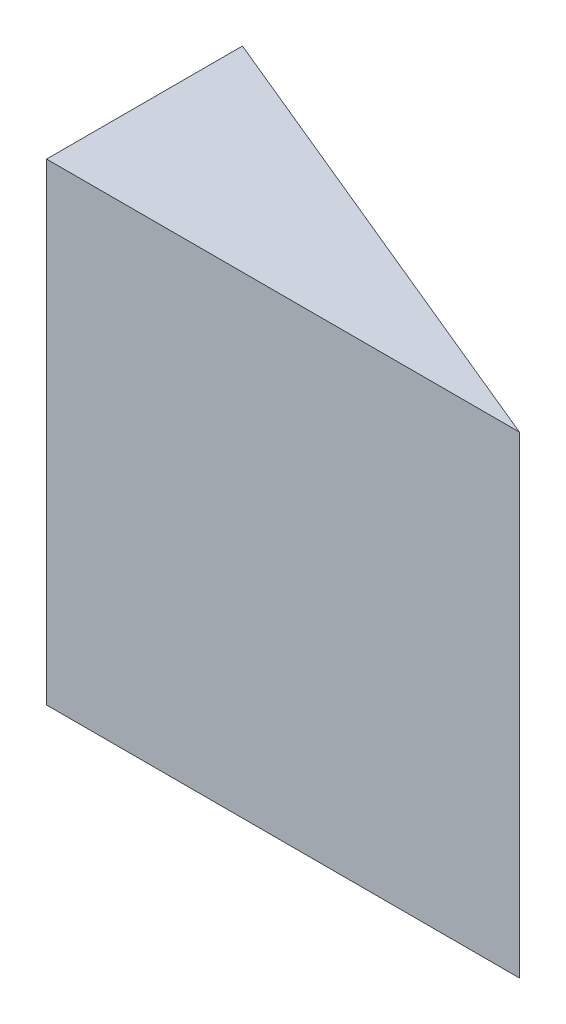
from build123d import *

# Parameters (mm, degrees)
BOSS_EXTRUDE1_DEPTH = 12.7


with BuildPart() as part:
    # Sketch1 → Boss-Extrude1 (new, symmetric)
    with BuildSketch(Plane(origin=(0, 0, 0), x_dir=(1, 0, 0), z_dir=(0, 1, 0))):
        Polygon((12.7, -13.082931372), (-12.7, -2.561906888), (-12.7, -13.082931372), align=None)
    extrude(amount=BOSS_EXTRUDE1_DEPTH, both=True)


solid = part.part
